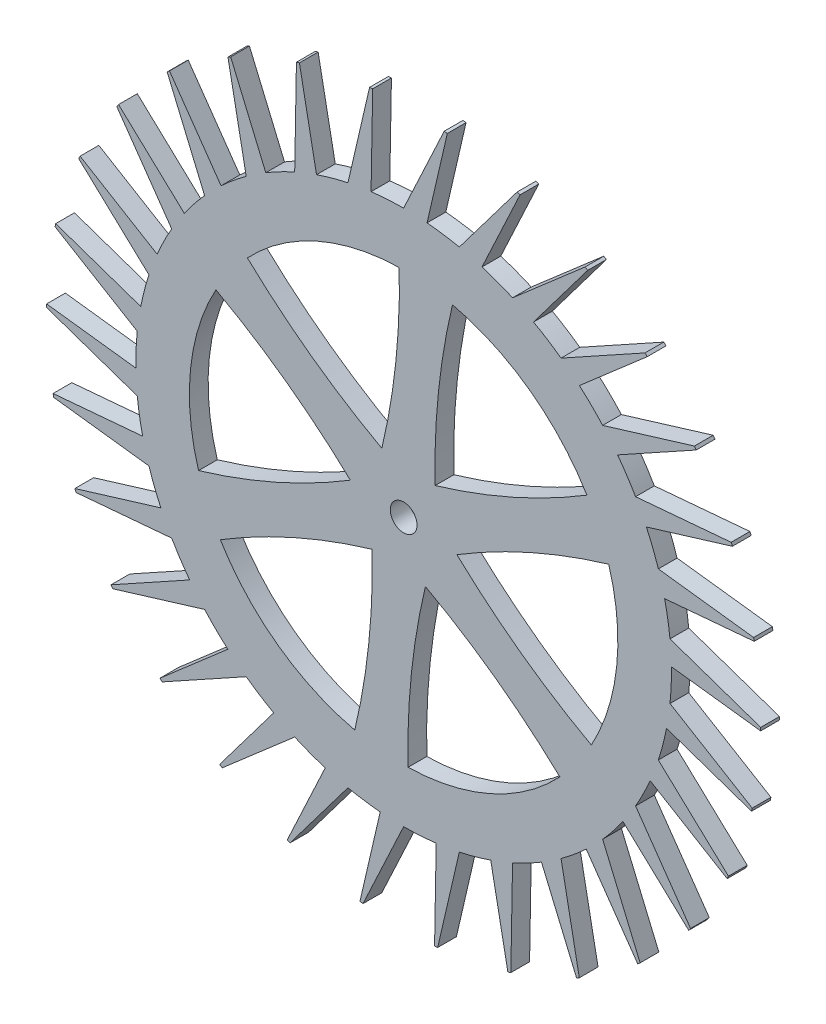
from build123d import *

# Parameters (mm, degrees)
SKETCH1_R           = 63.5
BOSS_EXTRUDE1_DEPTH = 4.445
BOSS_EXTRUDE2_START = -4.445
BOSS_EXTRUDE2_DEPTH = 4.445
CIRPATTERN1_COUNT   = 30
SKETCH3_R           = 3.175
CUT_EXTRUDE1_DEPTH  = 120.591712413
CUT_EXTRUDE2_DEPTH  = 120.591712413


with BuildPart() as part:
    # Sketch1 → Boss-Extrude1 (new body)
    with BuildSketch(Plane.XY):
        Circle(SKETCH1_R)
    extrude(amount=BOSS_EXTRUDE1_DEPTH)

    # Sketch2 → Boss-Extrude2 (add)
    with BuildSketch(Plane.XY.offset(4.445).offset(BOSS_EXTRUDE2_START)):
        with BuildLine():
            Line((9.626690277, 84.117518638), (0, 63.5))
            ThreePointArc((0, 63.5), (2.779385353, 63.439144202), (5.553443409, 63.256693451))
            Line((5.553443409, 63.256693451), (10.360378235, 84.030308047))
            Line((10.360378235, 84.030308047), (9.626690277, 84.117518638))
        make_face()
    boss_extrude2 = extrude(amount=BOSS_EXTRUDE2_DEPTH)

    # CirPattern1: Boss-Extrude2 ×30 about axis
    cirpattern1_axis = Axis((0, 0, 0), (0, 0, 1))
    for i in range(1, CIRPATTERN1_COUNT):
        add(boss_extrude2.rotate(cirpattern1_axis, i * 360 / CIRPATTERN1_COUNT))

    # Sketch3 → Cut-Extrude1 (cut, through all)
    with BuildSketch(Plane.XY.offset(4.445)):
        Circle(SKETCH3_R)
    extrude(amount=-CUT_EXTRUDE1_DEPTH, mode=Mode.SUBTRACT)

    # Sketch4 → Cut-Extrude2 (cut, through all)
    with BuildSketch(Plane.XY.offset(4.445)):
        with BuildLine():
            Line((-5.165555367, 11.602027312), (-1.046816164, 50.789213185))
            ThreePointArc((-1.046816164, 50.789213185), (-20.662221468, 46.408109248), (-37.043284234, 34.76255303))
            ThreePointArc((-37.043284234, 34.76255303), (-21.850907071, 22.154838588), (-5.165555367, 11.602027312))
        make_face()
        with BuildLine():
            ThreePointArc((-48.626896141, -14.699148671), (-30.11210657, -7.846021325), (-12.630428071, 1.327511483))
            ThreePointArc((-12.630428071, 1.327511483), (-27.822805234, 13.935225925), (-44.508156938, 24.488037201))
            ThreePointArc((-44.508156938, 24.488037201), (-50.521712285, 5.310045934), (-48.626896141, -14.699148671))
        make_face()
        with BuildLine():
            ThreePointArc((-11.583611907, -49.461701701), (-8.261199499, -30.000859913), (-7.464872704, -10.274515829))
            ThreePointArc((-7.464872704, -10.274515829), (-25.979662276, -17.127643175), (-43.461340774, -26.301175983))
            ThreePointArc((-43.461340774, -26.301175983), (-29.859490816, -41.098063314), (-11.583611907, -49.461701701))
        make_face()
        with BuildLine():
            ThreePointArc((37.043284234, -34.76255303), (21.850907071, -22.154838588), (5.165555367, -11.602027312))
            ThreePointArc((5.165555367, -11.602027312), (1.843142958, -31.0628691), (1.046816164, -50.789213185))
            ThreePointArc((1.046816164, -50.789213185), (20.662221468, -46.408109248), (37.043284234, -34.76255303))
        make_face()
        with BuildLine():
            ThreePointArc((48.626896141, 14.699148671), (30.11210657, 7.846021325), (12.630428071, -1.327511483))
            ThreePointArc((12.630428071, -1.327511483), (27.822805234, -13.935225925), (44.508156938, -24.488037201))
            ThreePointArc((44.508156938, -24.488037201), (49.201902262, -12.64170929), (50.8, 0))
            ThreePointArc((50.8, 0), (50.253787539, 7.429457451), (48.626896141, 14.699148671))
        make_face()
        with BuildLine():
            ThreePointArc((43.461340774, 26.301175983), (29.859490816, 41.098063314), (11.583611907, 49.461701701))
            Line((11.583611907, 49.461701701), (7.464872704, 10.274515829))
            ThreePointArc((7.464872704, 10.274515829), (25.979662276, 17.127643175), (43.461340774, 26.301175983))
        make_face()
        with BuildLine():
            Line((-1.046816164, 50.789213185), (-5.165555367, 11.602027312))
            ThreePointArc((-5.165555367, 11.602027312), (-1.843142958, 31.0628691), (-1.046816164, 50.789213185))
        make_face()
        with BuildLine():
            ThreePointArc((7.464872704, 10.274515829), (8.261199499, 30.000859913), (11.583611907, 49.461701701))
            Line((11.583611907, 49.461701701), (7.464872704, 10.274515829))
        make_face()
    extrude(amount=-CUT_EXTRUDE2_DEPTH, mode=Mode.SUBTRACT)


solid = part.part
